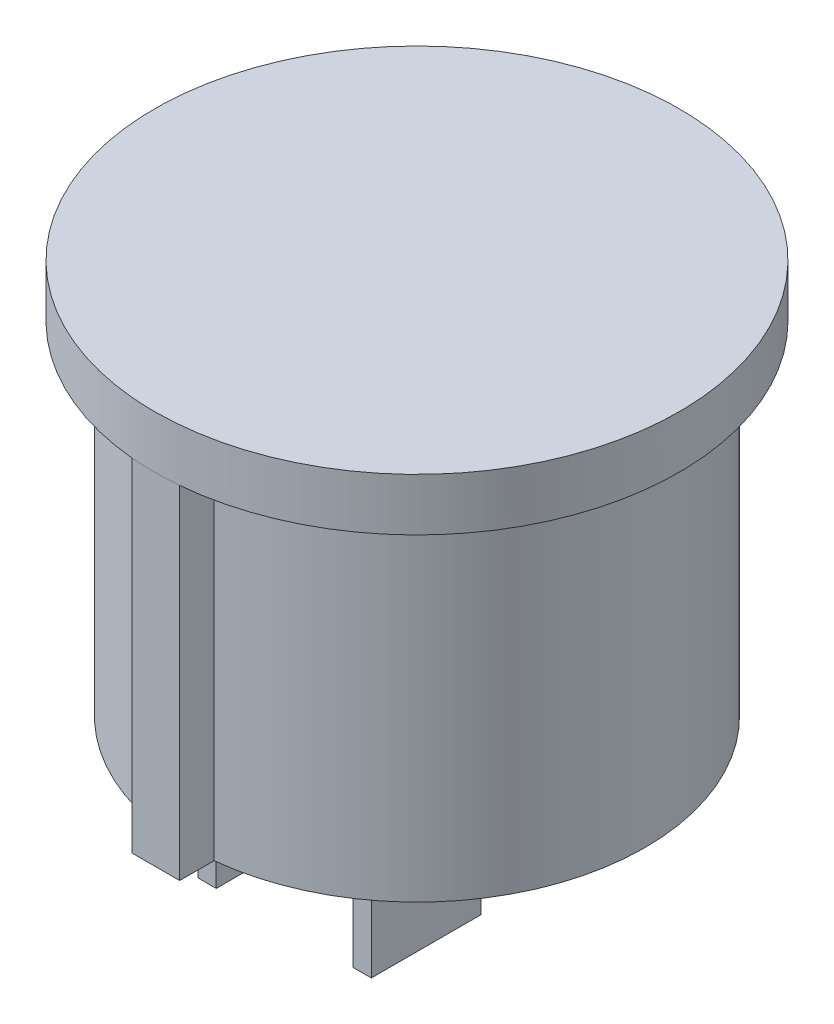
from build123d import *

# Parameters (mm, degrees)
SKETCH2_R           = 10
BOSS_EXTRUDE1_DEPTH = 15
SKETCH3_R           = 11.5
BOSS_EXTRUDE2_DEPTH = 2.3
SKETCH4_W           = 0.8
SKETCH4_H           = 4.8
BOSS_EXTRUDE3_DEPTH = 8.55
BOSS_EXTRUDE4_DEPTH = 15


with BuildPart() as part:
    # Sketch2 → Boss-Extrude1 (new body)
    with BuildSketch(Plane(origin=(0, 0, 0), x_dir=(1, 0, 0), z_dir=(0, 1, 0))):
        with Locations(Location((0, 0, 0), (0, 0, 270))):
            Circle(SKETCH2_R)
    extrude(amount=BOSS_EXTRUDE1_DEPTH)

    # Sketch3 → Boss-Extrude2 (add)
    with BuildSketch(Plane(origin=(0, 15, 0), x_dir=(1, 0, 0), z_dir=(0, 1, 0))):
        with Locations(Location((0, 0, 0), (0, 0, 270))):
            Circle(SKETCH3_R)
    extrude(amount=BOSS_EXTRUDE2_DEPTH)

    # Sketch4 → Boss-Extrude3 (add)
    with BuildSketch(Plane.XZ):
        Rectangle(SKETCH4_W, SKETCH4_H)
        with Locations((-6.8, 0)):
            Rectangle(SKETCH4_W, SKETCH4_H)
    extrude(amount=BOSS_EXTRUDE3_DEPTH)

    # Sketch5 → Boss-Extrude4 (add)
    with BuildSketch(Plane.XZ):
        with BuildLine():
            Line((-1.05, 9.944722218), (-1.05, 11.451964897))
            Line((-1.05, 11.451964897), (1.05, 11.451964897))
            Line((1.05, 11.451964897), (1.05, 9.944722218))
            ThreePointArc((1.05, 9.944722218), (0, 10), (-1.05, 9.944722218))
        make_face()
    extrude(amount=-BOSS_EXTRUDE4_DEPTH)


solid = part.part
